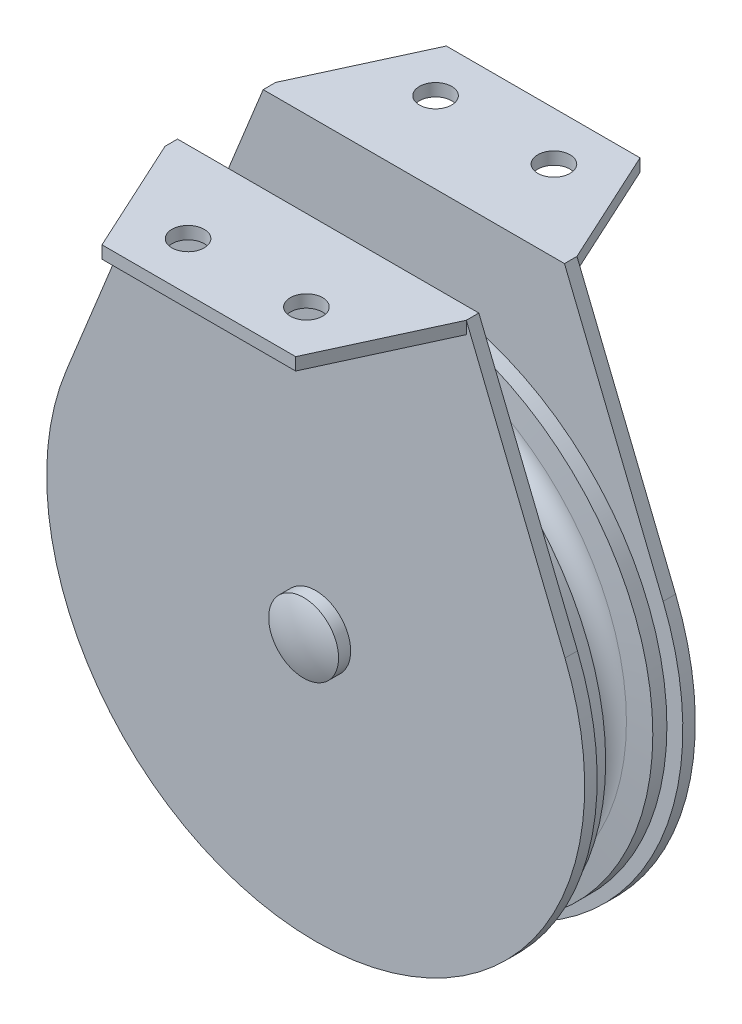
from build123d import *

# Parameters (mm, degrees)
BOSS_EXTRUDE1_DEPTH = 1.8415
SKETCH5_R           = 2.38125
BOSS_EXTRUDE2_DEPTH = 1.8415
SKETCH6_R           = 5.1562
BOSS_EXTRUDE3_DEPTH = 1.778
DOME4_FACE_RADIUS   = 5.1562
DOME4_HEIGHT        = 1.016
SKETCH8_R           = 6.35
BOSS_EXTRUDE4_DEPTH = 1.778
DOME7_FACE_RADIUS   = 6.35
DOME7_HEIGHT        = 3.9624
BOSS_EXTRUDE5_REACH = 74.677
SKETCH9_R           = 3.57505


with BuildPart() as part:
    # Sketch3 → Revolve1 (revolve)
    with BuildSketch(Plane(origin=(0, 0, 0), x_dir=(0, 0, -1), z_dir=(1, 0, 0)), mode=Mode.PRIVATE) as revolve1_sk:
        with BuildLine():
            Line((-5.55625, 38.1), (-5.55625, 0))
            Line((-5.55625, 0), (5.55625, 0))
            Line((5.55625, 0), (5.55625, 38.1))
            Line((5.55625, 38.1), (3.476015551, 38.1))
            Line((3.476015551, 38.1), (3.162918166, 34.521280517))
            ThreePointArc((3.162918166, 34.521280517), (0, 31.623), (-3.162918166, 34.521280517))
            Line((-3.162918166, 34.521280517), (-3.476015551, 38.1))
            Line((-3.476015551, 38.1), (-5.55625, 38.1))
        make_face()
    revolve(revolve1_sk.sketch.rotate(Axis((0, 0, 5.55625), (0, 0, -1)), 90), axis=Axis((0, 0, 5.55625), (0, 0, -1)))



with BuildPart() as body_2:
    # Sketch4 → Boss-Extrude1 (new body)
    with BuildSketch(Plane.XY.offset(6.31825)):
        with BuildLine():
            Line((22.225, 50.8), (-22.225, 50.8))
            Line((-22.225, 50.8), (-36.778077648, 14.915450404))
            ThreePointArc((-36.778077648, 14.915450404), (0, -39.6875), (36.778077648, 14.915450404))
            Line((36.778077648, 14.915450404), (22.225, 50.8))
        make_face()
    extrude(amount=BOSS_EXTRUDE1_DEPTH)

    # Sketch5 → Boss-Extrude2 (add)
    with BuildSketch(Plane(origin=(0, 50.8, 97.5995), x_dir=(-1, 0, 0), z_dir=(0, -1, 0))):
        Polygon((-14.2875, 72.1995), (14.2875, 72.1995), (22.225, 89.43975), (-22.225, 89.43975), align=None)
        with Locations(Location((-8.73125, 79.34325, 0), (0, 0, 90))):
            Circle(SKETCH5_R, mode=Mode.SUBTRACT)
        with Locations(Location((8.73125, 79.34325, 0), (0, 0, 90))):
            Circle(SKETCH5_R, mode=Mode.SUBTRACT)
    extrude(amount=BOSS_EXTRUDE2_DEPTH)


with BuildPart() as body_3:
    # Mirror1: mirrored copy
    add(body_2.part.mirror(Plane.XY))


with BuildPart() as body_2_1:
    add(body_2.part)

    # Sketch6 → Boss-Extrude3 (add)
    with BuildSketch(Plane.XY.offset(8.15975)):
        Circle(SKETCH6_R)
    extrude(amount=BOSS_EXTRUDE3_DEPTH)

    # Dome4: a dome of height H over a round flat face of radius A is a cap of a sphere of radius (A * A + H * H) / (2 * H)
    dome4_r = (DOME4_FACE_RADIUS * DOME4_FACE_RADIUS + DOME4_HEIGHT * DOME4_HEIGHT) / (2 * DOME4_HEIGHT)
    dome4_base = Plane((0, 0, 9.93775), z_dir=(0, 0, 1))
    with Locations(dome4_base.offset(DOME4_HEIGHT - dome4_r)):
        dome4_ball = Sphere(dome4_r, mode=Mode.PRIVATE)
    add(split(dome4_ball, bisect_by=dome4_base, keep=Keep.TOP, mode=Mode.PRIVATE))


with BuildPart() as body_4:
    # Sketch8 → Boss-Extrude4 (new body)
    with BuildSketch(Plane(origin=(0, 0, -8.15975), x_dir=(-1, 0, 0), z_dir=(0, 0, -1))):
        Circle(SKETCH8_R)
    extrude(amount=BOSS_EXTRUDE4_DEPTH)

    # Dome7: a dome of height H over a round flat face of radius A is a cap of a sphere of radius (A * A + H * H) / (2 * H)
    dome7_r = (DOME7_FACE_RADIUS * DOME7_FACE_RADIUS + DOME7_HEIGHT * DOME7_HEIGHT) / (2 * DOME7_HEIGHT)
    dome7_base = Plane((0, 0, -9.93775), z_dir=(0, 0, -1))
    with Locations(dome7_base.offset(DOME7_HEIGHT - dome7_r)):
        dome7_ball = Sphere(dome7_r, mode=Mode.PRIVATE)
    add(split(dome7_ball, bisect_by=dome7_base, keep=Keep.TOP, mode=Mode.PRIVATE))


with BuildPart() as part_1:
    add(part.part)

    # Boss-Extrude5: up to this face of the body (flat: up to its plane)
    boss_extrude5_end = Plane(body_3.part.faces().sort_by_distance((0, 5.154216825, -8.15975))[0])
    # Sketch9 → Boss-Extrude5 (add, up to the picked face)
    with BuildSketch(Plane.XY.offset(8.15975), mode=Mode.PRIVATE) as boss_extrude5_sk1:
        Circle(SKETCH9_R)
    boss_extrude5_tool1 = split(extrude(boss_extrude5_sk1.sketch, amount=-BOSS_EXTRUDE5_REACH, mode=Mode.PRIVATE), bisect_by=boss_extrude5_end, keep=Keep.BOTH, mode=Mode.PRIVATE)

    add(body_2_1.part)  # Boss-Extrude5 merges body 2
    add(boss_extrude5_tool1.solids().sort_by(Axis((0, 0, 8.15975), (0, 0, -1)))[0])


solid = Compound([body_3.part, body_4.part, part_1.part])
